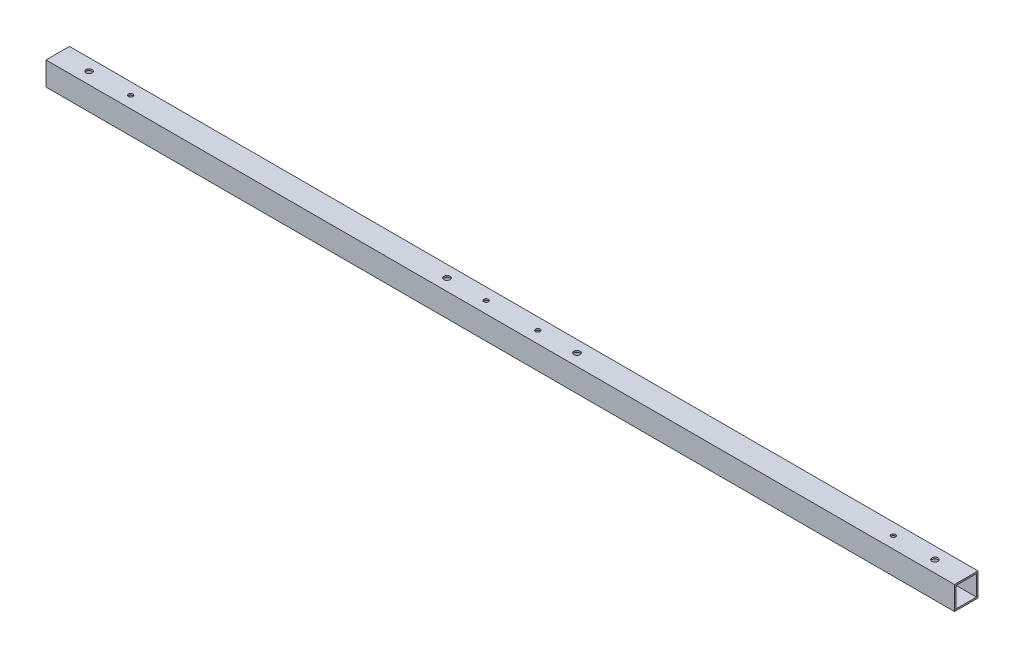
from build123d import *

# Parameters (mm, degrees)
SKETCH_11_W         = 15
SKETCH_11_H         = 15
SKETCH_11_W_2       = 13
SKETCH_11_H_2       = 13
F_15X15X1_1_DEPTH   = 640
SKETCH_12_R         = 1.95
CUT_EXTRUDE_1_DEPTH = 321.43915179
SKETCH_13_R         = 1.45
CUT_EXTRUDE_2_DEPTH = 321.43915179
SKETCH_14_R         = 1.45
CUT_EXTRUDE_3_DEPTH = 321.43915179
SKETCH_15_W         = 44.103354617
SKETCH_15_H         = 76.02578272
SKETCH_15_W_2       = 30.662332257
SKETCH_15_H_2       = 81.486198053
CUT_EXTRUDE_4_DEPTH = 321.43915179


with BuildPart() as part:
    # 草图11 → 铝管 15X15X1(1) (new body)
    with BuildSketch(Plane(origin=(-320, 0, 0), x_dir=(0, 0, -1), z_dir=(1, 0, 0))):
        Rectangle(SKETCH_11_W, SKETCH_11_H)
        Rectangle(SKETCH_11_W_2, SKETCH_11_H_2, mode=Mode.SUBTRACT)
    extrude(amount=F_15X15X1_1_DEPTH)

    # 草图12 → 切除-拉伸1 (cut, through all)
    with BuildSketch(Plane(origin=(0, 7.5, 0), x_dir=(1, 0, 0), z_dir=(0, 1, 0))):
        with Locations(Location((-41.5, 0, 0), (0, 0, 270))):
            Circle(SKETCH_12_R)
        with Locations(Location((-270, 0, 0), (0, 0, 270))):
            Circle(SKETCH_12_R)
        with Locations(Location((270, 0, 0), (0, 0, 90))):
            Circle(SKETCH_12_R)
        with Locations(Location((41.5, 0, 0), (0, 0, 90))):
            Circle(SKETCH_12_R)
    extrude(amount=-CUT_EXTRUDE_1_DEPTH, mode=Mode.SUBTRACT)

    # 草图13 → 切除-拉伸2 (cut, through all)
    with BuildSketch(Plane(origin=(0, 7.5, 0), x_dir=(1, 0, 0), z_dir=(0, 1, 0))):
        with Locations(Location((-243.5, 0, 0), (0, 0, 270))):
            Circle(SKETCH_13_R)
        with Locations(Location((243.5, 0, 0), (0, 0, 90))):
            Circle(SKETCH_13_R)
    extrude(amount=-CUT_EXTRUDE_2_DEPTH, mode=Mode.SUBTRACT)

    # 草图14 → 切除-拉伸3 (cut, through all)
    with BuildSketch(Plane(origin=(0, 7.5, 0), x_dir=(1, 0, 0), z_dir=(0, 1, 0))):
        with Locations(Location((-16.5, 0, 0), (0, 0, 270))):
            Circle(SKETCH_14_R)
        with Locations(Location((16.5, 0, 0), (0, 0, 270))):
            Circle(SKETCH_14_R)
    extrude(amount=-CUT_EXTRUDE_3_DEPTH, mode=Mode.SUBTRACT)

    # 草图15 → 切除-拉伸4 (cut, through all)
    with BuildSketch(Plane(origin=(0, 7.5, 0), x_dir=(1, 0, 0), z_dir=(0, 1, 0))):
        with Locations((-312.051677309, 7.560575077)):
            Rectangle(SKETCH_15_W, SKETCH_15_H)
        with Locations((305.331166129, -3.150239616)):
            Rectangle(SKETCH_15_W_2, SKETCH_15_H_2)
    extrude(amount=-CUT_EXTRUDE_4_DEPTH, mode=Mode.SUBTRACT)


solid = part.part
